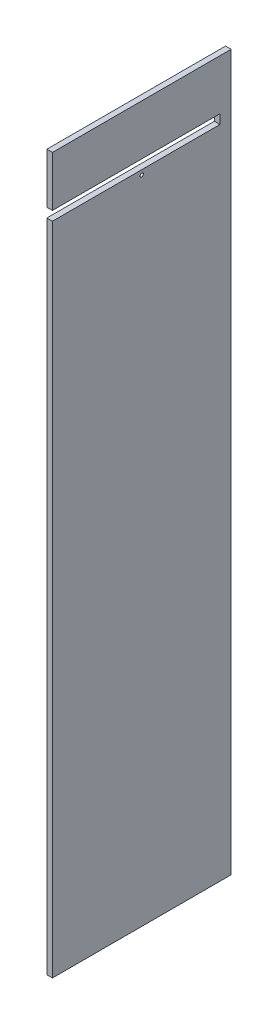
from build123d import *

# Parameters (mm, degrees)
SKETCH1_W             = 4.7625
SKETCH1_H             = 152.4
BOSS_EXTRUDE1_DEPTH   = 609.6
SKETCH2_W             = 142.875
SKETCH2_H             = 7.9375
CUT_EXTRUDE1_DEPTH    = 629.379345146
F_4_CLEARANCE_HOLE1_D = 2.9464


with BuildPart() as part:
    # Sketch1 → Boss-Extrude1 (new body)
    with BuildSketch(Plane(origin=(0, 0, 0), x_dir=(1, 0, 0), z_dir=(0, 1, 0))):
        with Locations((2.38125, 76.2)):
            Rectangle(SKETCH1_W, SKETCH1_H)
    extrude(amount=BOSS_EXTRUDE1_DEPTH)

    # Sketch2 → Cut-Extrude1 (cut, through all)
    with BuildSketch(Plane(origin=(4.7625, 0, 0), x_dir=(0, 0, -1), z_dir=(1, 0, 0))):
        with Locations((71.4375, 562.76875)):
            Rectangle(SKETCH2_W, SKETCH2_H)
    extrude(amount=-CUT_EXTRUDE1_DEPTH, mode=Mode.SUBTRACT)

    # #4 Clearance Hole1 (through all)
    with Locations(Plane(origin=(4.7625, 0, 0), x_dir=(0, 0, -1), z_dir=(1, 0, 0))):
        with Locations((76.2, 554.83125)):
            Hole(F_4_CLEARANCE_HOLE1_D / 2)


solid = part.part
